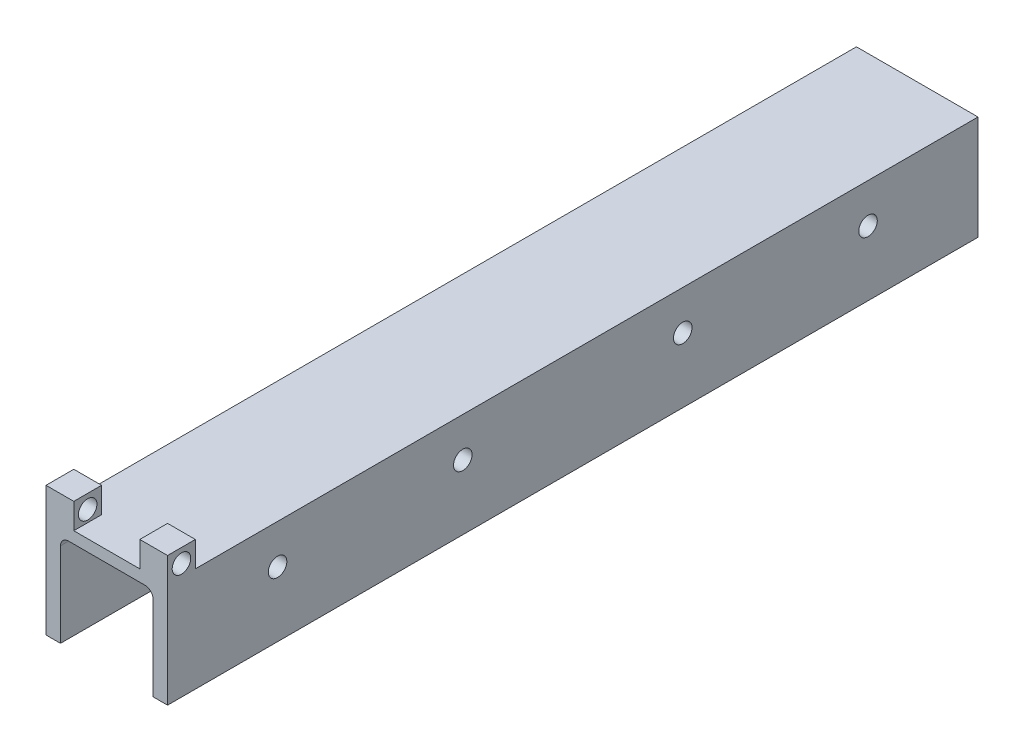
from build123d import *

# Parameters (mm, degrees)
BOSS_EXTRUDE2_DEPTH     = 177.8
SKETCH19_R              = 2.032
CUT_EXTRUDE3_DEPTH      = 182.236609161
SKETCH21_W              = 6.096
SKETCH21_H              = 6.096
BOSS_EXTRUDE4_DEPTH     = 5.588
CUT_EXTRUDE4_DEPTH      = 182.233049359
CUT_EXTRUDE4_DEPTH_BACK = 182.233049359
SKETCH22_R              = 2.032


with BuildPart() as part:
    # Sketch2 → Boss-Extrude2 (new body)
    with BuildSketch(Plane.XY):
        with BuildLine():
            Line((0, 0), (0, 22.86))
            Line((0, 22.86), (26.67, 22.86))
            Line((26.67, 22.86), (26.67, 0))
            Line((26.67, 0), (23.495, 0))
            Line((23.495, 0), (23.495, 18.542))
            ThreePointArc((23.495, 18.542), (22.974235857, 19.799235857), (21.717, 20.32))
            Line((21.717, 20.32), (4.953, 20.32))
            ThreePointArc((4.953, 20.32), (3.695764143, 19.799235857), (3.175, 18.542))
            Line((3.175, 18.542), (3.175, 0))
            Line((3.175, 0), (0, 0))
        make_face()
    extrude(amount=-BOSS_EXTRUDE2_DEPTH)

    # Sketch19 → Cut-Extrude3 (cut, through all)
    with BuildSketch(Plane(origin=(0, 0, 0), x_dir=(0, 0, -1), z_dir=(1, 0, 0))):
        with Locations((24.13, 14.224)):
            Circle(SKETCH19_R)
        with Locations((64.77, 14.224)):
            Circle(SKETCH19_R)
        with Locations(Location((113.03, 14.224, 0), (0, 0, 180))):
            Circle(SKETCH19_R)
        with Locations(Location((153.67, 14.224, 0), (0, 0, 180))):
            Circle(SKETCH19_R)
    extrude(amount=CUT_EXTRUDE3_DEPTH, mode=Mode.SUBTRACT)

    # Sketch21 → Boss-Extrude4 (add)
    with BuildSketch(Plane(origin=(0, 22.86, 0), x_dir=(1, 0, 0), z_dir=(0, 1, 0))):
        with Locations((3.048, 3.048)):
            Rectangle(SKETCH21_W, SKETCH21_H)
        with Locations((23.622, 3.048)):
            Rectangle(SKETCH21_W, SKETCH21_H)
    extrude(amount=BOSS_EXTRUDE4_DEPTH)

    # Sketch22 → Cut-Extrude4 (cut, two sides: drawn at the far end of the back side and taken through both)
    with BuildSketch(Plane.ZY.offset(-20.574).offset(-CUT_EXTRUDE4_DEPTH_BACK)):
        with Locations((-3.048, 25.4)):
            Circle(SKETCH22_R)
    extrude(amount=CUT_EXTRUDE4_DEPTH + CUT_EXTRUDE4_DEPTH_BACK, mode=Mode.SUBTRACT)


solid = part.part
